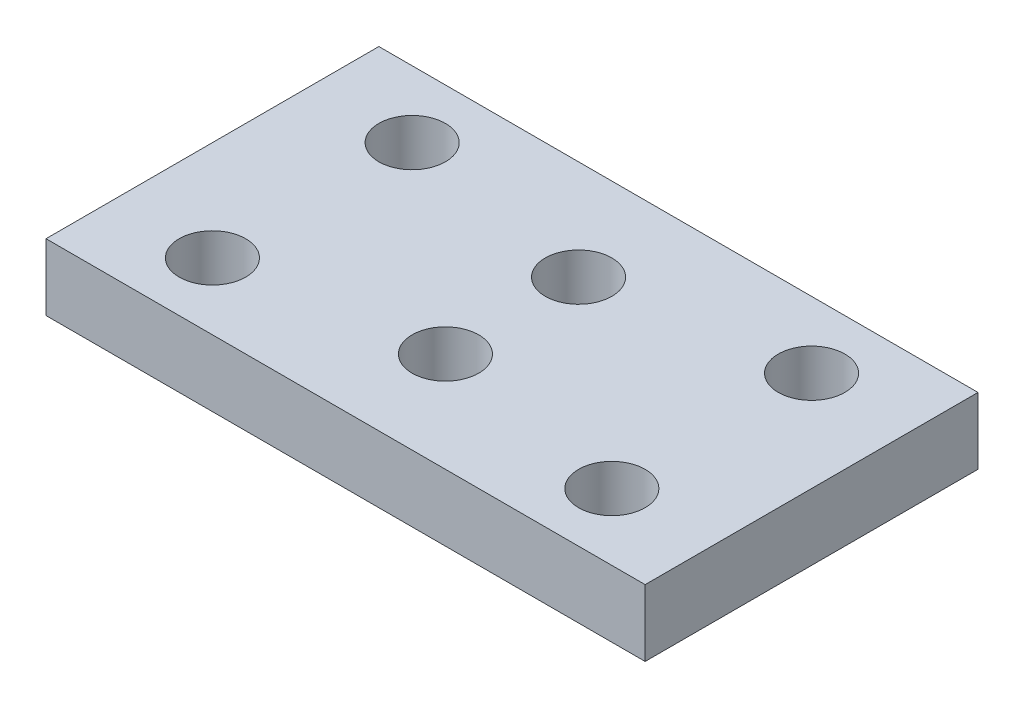
from build123d import *

# Parameters (mm, degrees)
SKETCH1_W           = 57.15
SKETCH1_H           = 31.75
SKETCH1_R           = 3.175
BOSS_EXTRUDE1_DEPTH = 6.35


with BuildPart() as part:
    # Sketch1 → Boss-Extrude1 (new body)
    with BuildSketch(Plane(origin=(0, 0, 0), x_dir=(1, 0, 0), z_dir=(0, 1, 0))):
        with Locations((28.575, 15.875)):
            Rectangle(SKETCH1_W, SKETCH1_H)
        with Locations(Location((9.525, 25.4, 0), (0, 0, 270))):
            Circle(SKETCH1_R, mode=Mode.SUBTRACT)
        with Locations(Location((47.625, 25.4, 0), (0, 0, 270))):
            Circle(SKETCH1_R, mode=Mode.SUBTRACT)
        with Locations(Location((47.625, 6.35, 0), (0, 0, 270))):
            Circle(SKETCH1_R, mode=Mode.SUBTRACT)
        with Locations(Location((9.525, 6.35, 0), (0, 0, 270))):
            Circle(SKETCH1_R, mode=Mode.SUBTRACT)
        with Locations(Location((28.575, 22.225, 0), (0, 0, 270))):
            Circle(SKETCH1_R, mode=Mode.SUBTRACT)
        with Locations(Location((28.575, 9.525, 0), (0, 0, 270))):
            Circle(SKETCH1_R, mode=Mode.SUBTRACT)
    extrude(amount=BOSS_EXTRUDE1_DEPTH)


solid = part.part
